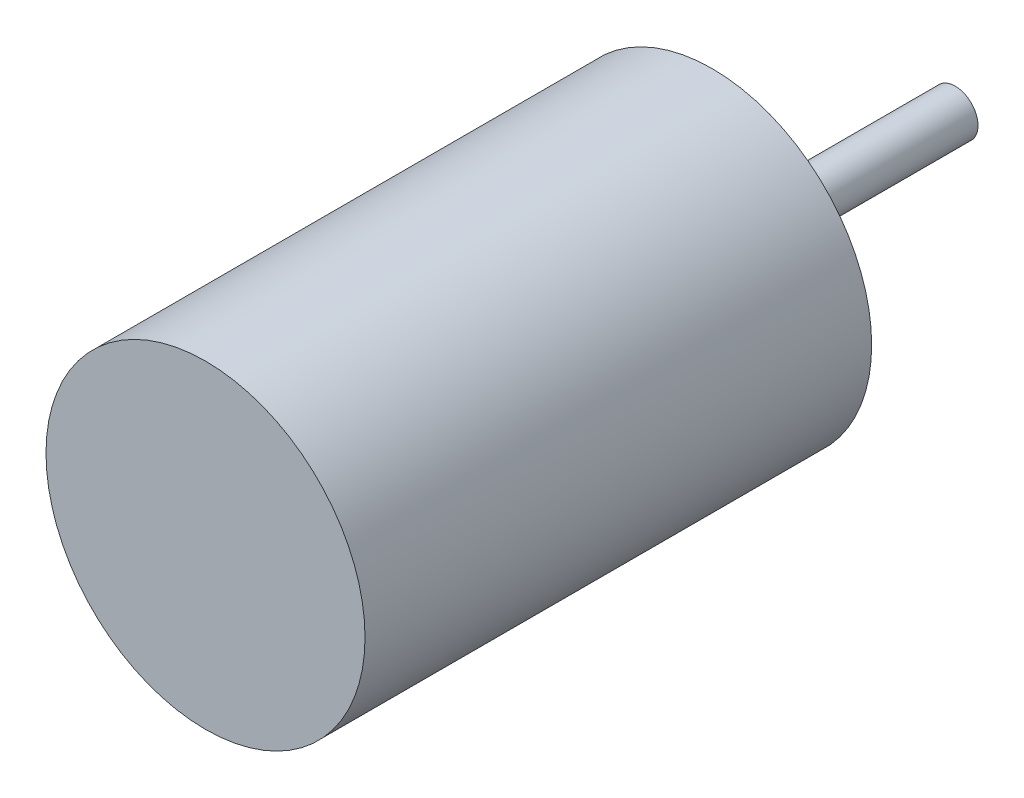
from build123d import *

# Parameters (mm, degrees)
SKETCH1_R           = 3
BOSS_EXTRUDE1_DEPTH = 32
SKETCH2_R           = 21
BOSS_EXTRUDE2_DEPTH = 66.7


with BuildPart() as part:
    # Sketch1 → Boss-Extrude1 (new body)
    with BuildSketch(Plane.XY):
        Circle(SKETCH1_R)
    extrude(amount=BOSS_EXTRUDE1_DEPTH)

    # Sketch2 → Boss-Extrude2 (add)
    with BuildSketch(Plane.XY.offset(32)):
        Circle(SKETCH2_R)
    extrude(amount=BOSS_EXTRUDE2_DEPTH)


solid = part.part
